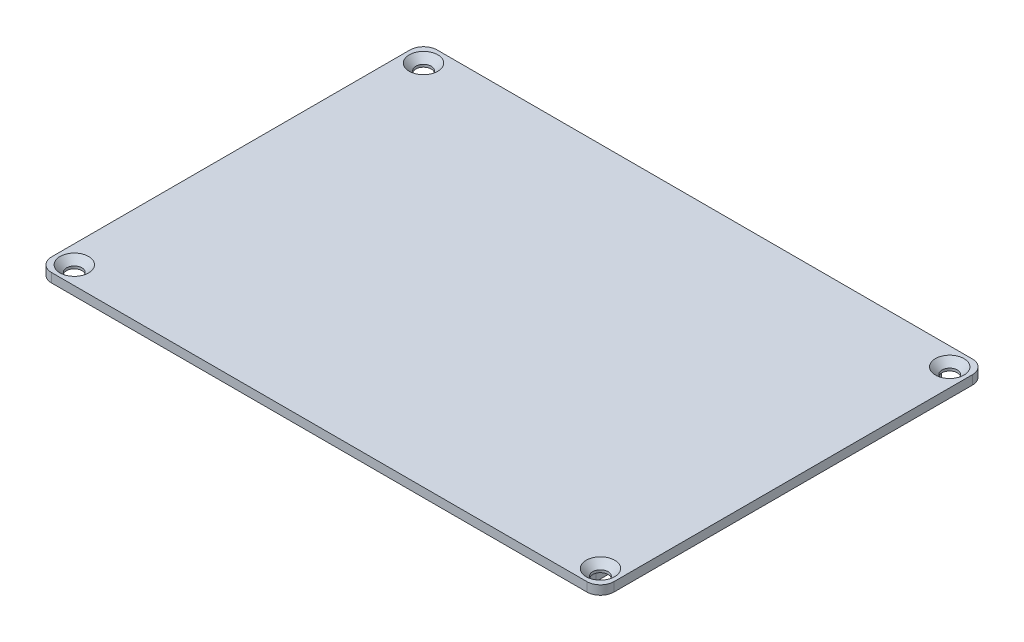
from build123d import *

# Parameters (mm, degrees)
SKIZZE1_W                                            = 112
SKIZZE1_H                                            = 81
SKIZZE1_W_2                                          = 108
SKIZZE1_H_2                                          = 77
AUFSATZ_LINEAR_AUSTRAGEN1_DEPTH                      = 2
SKIZZE2_W                                            = 124
SKIZZE2_H                                            = 85
AUFSATZ_LINEAR_AUSTRAGEN2_DEPTH                      = 2
VERRUNDUNG1_R                                        = 3
FORMSENKUNG_F_R_M3_LINSENSENKSCHRAUBE_MI_D           = 3.4
FORMSENKUNG_F_R_M3_LINSENSENKSCHRAUBE_MI_DEPTH       = 7.25
FORMSENKUNG_F_R_M3_LINSENSENKSCHRAUBE_MI_CSINK_D     = 6.3
FORMSENKUNG_F_R_M3_LINSENSENKSCHRAUBE_MI_CSINK_ANGLE = 90
FORMSENKUNG_F_R_M3_LINSENSENKSCHRAUBE_MI_TIP         = 1.021463052


with BuildPart() as part:
    # Skizze1 → Aufsatz-Linear austragen1 (new body)
    with BuildSketch(Plane(origin=(0, 0, 0), x_dir=(1, 0, 0), z_dir=(0, 1, 0))):
        with Locations((56, 40.5)):
            Rectangle(SKIZZE1_W, SKIZZE1_H)
        with Locations((56, 40.5)):
            Rectangle(SKIZZE1_W_2, SKIZZE1_H_2, mode=Mode.SUBTRACT)
    extrude(amount=AUFSATZ_LINEAR_AUSTRAGEN1_DEPTH)

    # Skizze2 → Aufsatz-Linear austragen2 (add)
    with BuildSketch(Plane(origin=(0, 2, 0), x_dir=(1, 0, 0), z_dir=(0, 1, 0))):
        with Locations((56, 40.5)):
            Rectangle(SKIZZE2_W, SKIZZE2_H)
    extrude(amount=AUFSATZ_LINEAR_AUSTRAGEN2_DEPTH)

    # Verrundung1
    verrundung1_edges = [part.edges().sort_by_distance(p)[0] for p in [
        (-6, 3, -83),
        (-6, 3, 2),
        (118, 3, 2),
        (118, 3, -83),
        (0, 1, -81),
        (112, 1, -81),
        (112, 1, 0),
        (0, 1, 0),
    ]]
    fillet(verrundung1_edges, radius=VERRUNDUNG1_R)

    # Formsenkung für M3 Linsensenkschraube mit Schlitz1
    with Locations(Plane(origin=(0, 4, 0), x_dir=(1, 0, 0), z_dir=(0, 1, 0))):
        with Locations((-2, 2), (114, 79), (-2, 79), (114, 2)):
            CounterSinkHole(FORMSENKUNG_F_R_M3_LINSENSENKSCHRAUBE_MI_D / 2, FORMSENKUNG_F_R_M3_LINSENSENKSCHRAUBE_MI_CSINK_D / 2, depth=FORMSENKUNG_F_R_M3_LINSENSENKSCHRAUBE_MI_DEPTH, counter_sink_angle=FORMSENKUNG_F_R_M3_LINSENSENKSCHRAUBE_MI_CSINK_ANGLE)
            with Locations((0, 0, -(FORMSENKUNG_F_R_M3_LINSENSENKSCHRAUBE_MI_DEPTH + FORMSENKUNG_F_R_M3_LINSENSENKSCHRAUBE_MI_TIP / 2))):  # 118° drill point
                Cone(0, FORMSENKUNG_F_R_M3_LINSENSENKSCHRAUBE_MI_D / 2, FORMSENKUNG_F_R_M3_LINSENSENKSCHRAUBE_MI_TIP, mode=Mode.SUBTRACT)


solid = part.part
